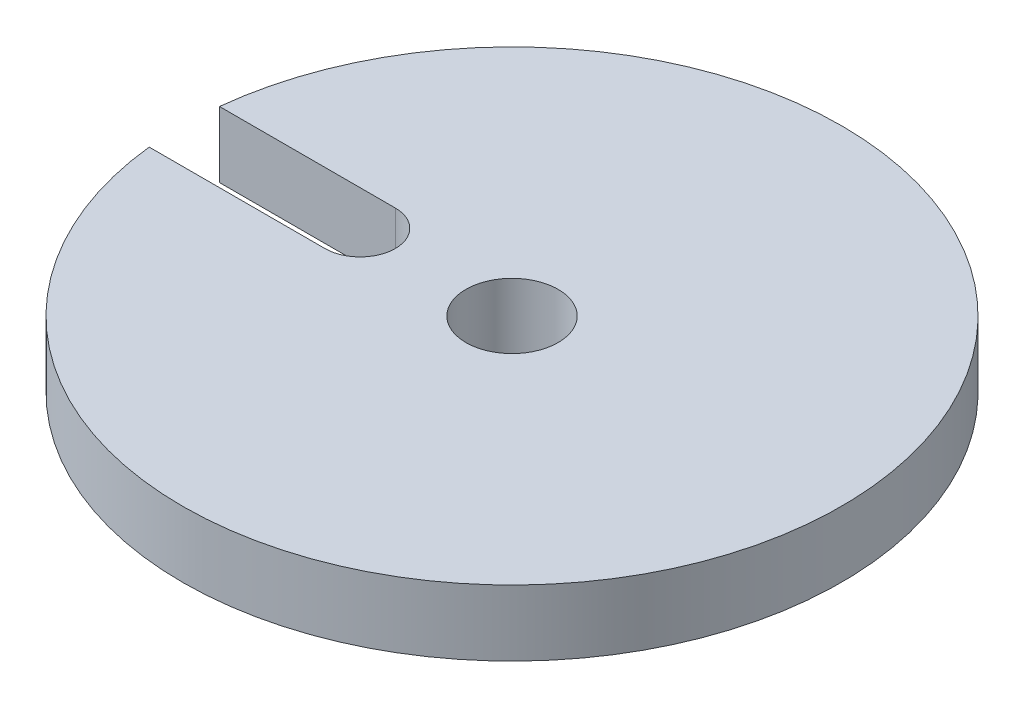
from build123d import *

# Parameters (mm, degrees)
SKETCH_1_R          = 15
SKETCH_1_R_2        = 2.1
EXTRUDE_1_DEPTH     = 3
CUT_EXTRUDE_1_DEPTH = 10


with BuildPart() as part:
    # ｽｹｯﾁ1 → ﾎﾞｽ - 押し出し1 (new body)
    with BuildSketch(Plane(origin=(0, 0, 0), x_dir=(1, 0, 0), z_dir=(0, 1, 0))):
        with Locations(Location((0, 0, 0), (0, 0, 270))):
            Circle(SKETCH_1_R)
        with Locations(Location((0, 0, 0), (0, 0, 270))):
            Circle(SKETCH_1_R_2, mode=Mode.SUBTRACT)
    extrude(amount=EXTRUDE_1_DEPTH)

    # ｽｹｯﾁ2 → ｶｯﾄ - 押し出し1 (cut)
    with BuildSketch(Plane(origin=(0, 3, 0), x_dir=(1, 0, 0), z_dir=(0, 1, 0))):
        with BuildLine():
            Line((-14.91442255, 1.6), (-6.91442255, 1.6))
            ThreePointArc((-6.91442255, 1.6), (-5.31442255, 0), (-6.91442255, -1.6))
            Line((-6.91442255, -1.6), (-14.91442255, -1.6))
            ThreePointArc((-14.91442255, -1.6), (-16.51442255, 0), (-14.91442255, 1.6))
        make_face()
    extrude(amount=-CUT_EXTRUDE_1_DEPTH, mode=Mode.SUBTRACT)


solid = part.part
